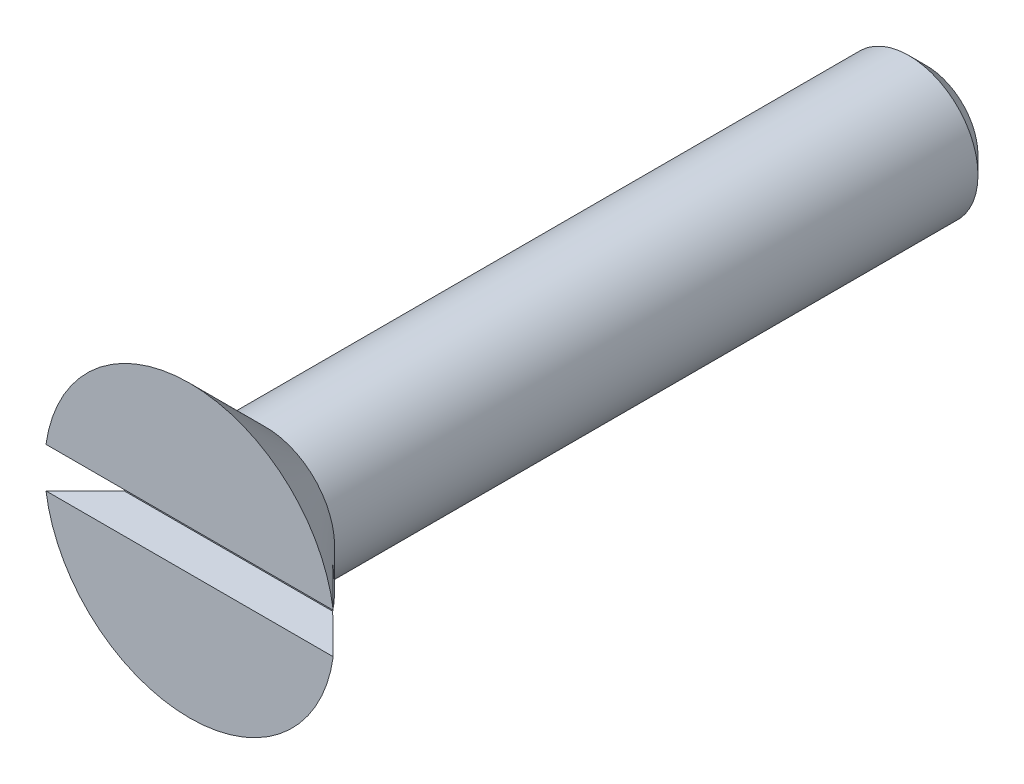
from build123d import *

# Parameters (mm, degrees)
SKETCH9_W          = 6.3
SKETCH9_H          = 0.875
CUT_EXTRUDE1_DEPTH = 0.85


with BuildPart() as part:
    # Sketch3 → Revolve1 (revolve)
    with BuildSketch(Plane(origin=(0, 0, 0), x_dir=(0, 0, -1), z_dir=(1, 0, 0)), mode=Mode.PRIVATE) as revolve1_sk:
        Polygon((-1.7, 3.15), (-0.05, 1.5), (13.925, 1.5), (14.3, 1.125), (14.3, 0), (-1.7, 0), align=None)
    revolve(revolve1_sk.sketch.rotate(Axis((0, 0, 1.7), (0, 0, -1)), 90), axis=Axis((0, 0, 1.7), (0, 0, -1)))

    # Sketch9 → Cut-Extrude1 (cut)
    with BuildSketch(Plane.XY.offset(1.7)):
        Rectangle(SKETCH9_W, SKETCH9_H)
    extrude(amount=-CUT_EXTRUDE1_DEPTH, mode=Mode.SUBTRACT)


solid = part.part
